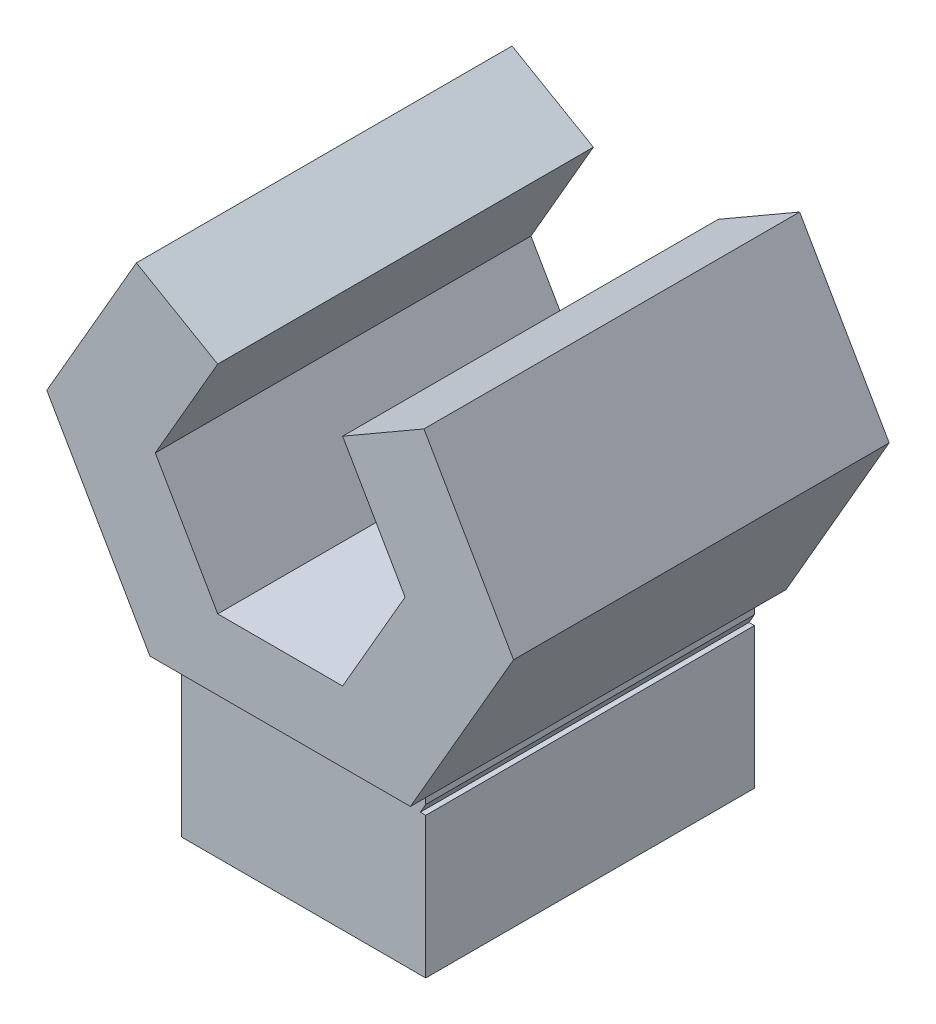
from build123d import *

# Parameters (mm, degrees)
EXTRUDE_1_DEPTH      = 8
SKETCH_2_W           = 9
SKETCH_2_H           = 8
EXTRUDE_2_DEPTH      = 3
SKETCH_3_OUTSIDE_W   = 15.256
SKETCH_3_OUTSIDE_H   = 13.318
SKETCH_3_OUTSIDE_W_2 = 5.2
SKETCH_3_OUTSIDE_H_2 = 7
SKETCH_3_OUTSIDE_W_3 = 2
SKETCH_3_OUTSIDE_H_3 = 5
CUT_EXTRUDE_1_DEPTH  = 3.5


with BuildPart() as part:
    # 草图1 → 凸台-拉伸1 (new body)
    with BuildSketch(Plane.XY):
        Polygon((-3.062050808, 3.303627574), (-4.969401077, 0), (-2.484700538, -4.303627574), (2.484700538, -4.303627574), (4.969401077, 0), (3.062050808, 3.303627574), (1.33, 2.303627574), (2.66, 0), (1.33, -2.303627574), (-1.33, -2.303627574), (-2.66, 0), (-1.33, 2.303627574), align=None)
    extrude(amount=EXTRUDE_1_DEPTH)

    # 草图2 → 凸台-拉伸2 (add)
    with BuildSketch(Plane.XZ.offset(4.303627574)):
        with Locations((0, 4)):
            Rectangle(SKETCH_2_W, SKETCH_2_H)
    extrude(amount=EXTRUDE_2_DEPTH)

    # 草图3 outside → 切除-拉伸1 (cut)
    # profile 1 of 2: a face of its own
    with BuildSketch(Plane.XZ.offset(7.303627574)):
        with Locations((0, 4)):
            Rectangle(SKETCH_3_OUTSIDE_W, SKETCH_3_OUTSIDE_H)
        with Locations((0, 4)):
            Rectangle(SKETCH_3_OUTSIDE_W_2, SKETCH_3_OUTSIDE_H_2, mode=Mode.SUBTRACT)
    # profile 2 of 2: a face of its own
    with BuildSketch(Plane.XZ.offset(7.303627574)):
        with Locations((0, 4)):
            Rectangle(SKETCH_3_OUTSIDE_W_3, SKETCH_3_OUTSIDE_H_3)
    extrude(amount=-CUT_EXTRUDE_1_DEPTH, mode=Mode.SUBTRACT)


solid = part.part
